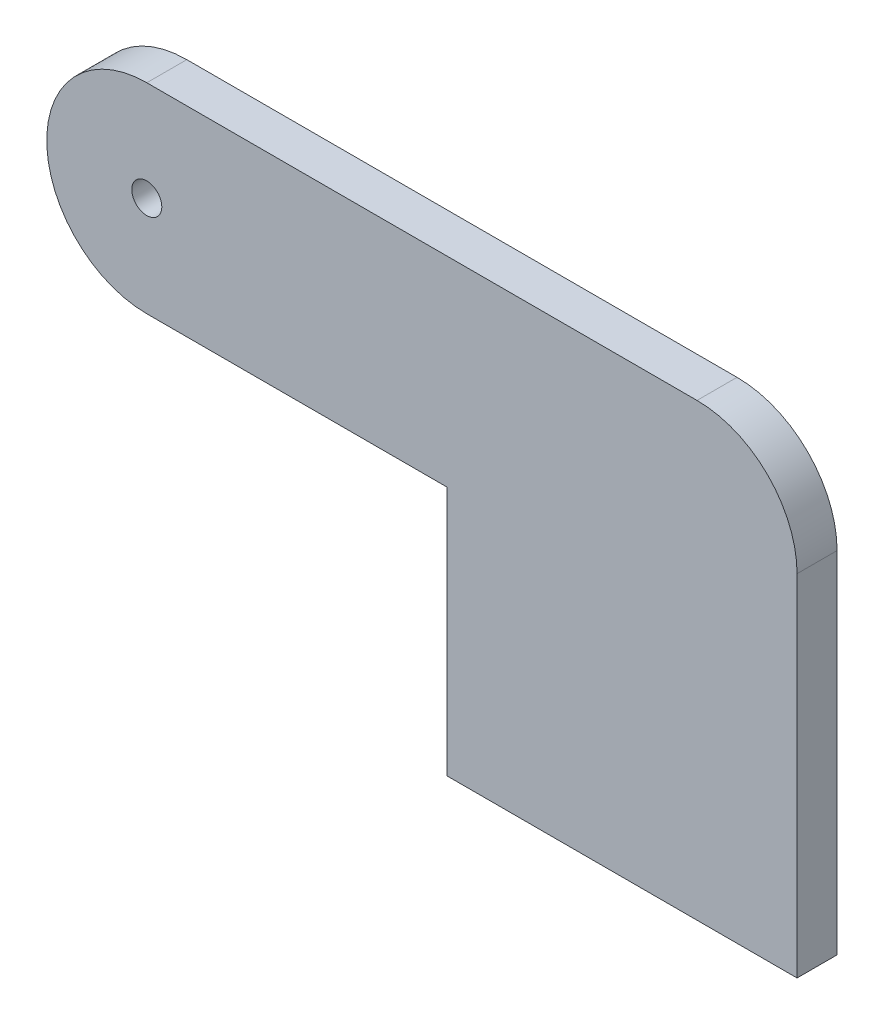
from build123d import *

# Parameters (mm, degrees)
SKETCH1_R           = 1.5
BOSS_EXTRUDE1_DEPTH = 4


with BuildPart() as part:
    # Sketch1 → Boss-Extrude1 (new body)
    with BuildSketch(Plane.XY):
        with BuildLine():
            Line((0, 10), (55, 10))
            ThreePointArc((55, 10), (62.071067812, 7.071067812), (65, 0))
            Line((65, 0), (65, -35))
            Line((65, -35), (30, -35))
            Line((30, -35), (30, -10))
            Line((30, -10), (0, -10))
            ThreePointArc((0, -10), (-10, 0), (0, 10))
        make_face()
        Circle(SKETCH1_R, mode=Mode.SUBTRACT)
    extrude(amount=BOSS_EXTRUDE1_DEPTH)


solid = part.part
